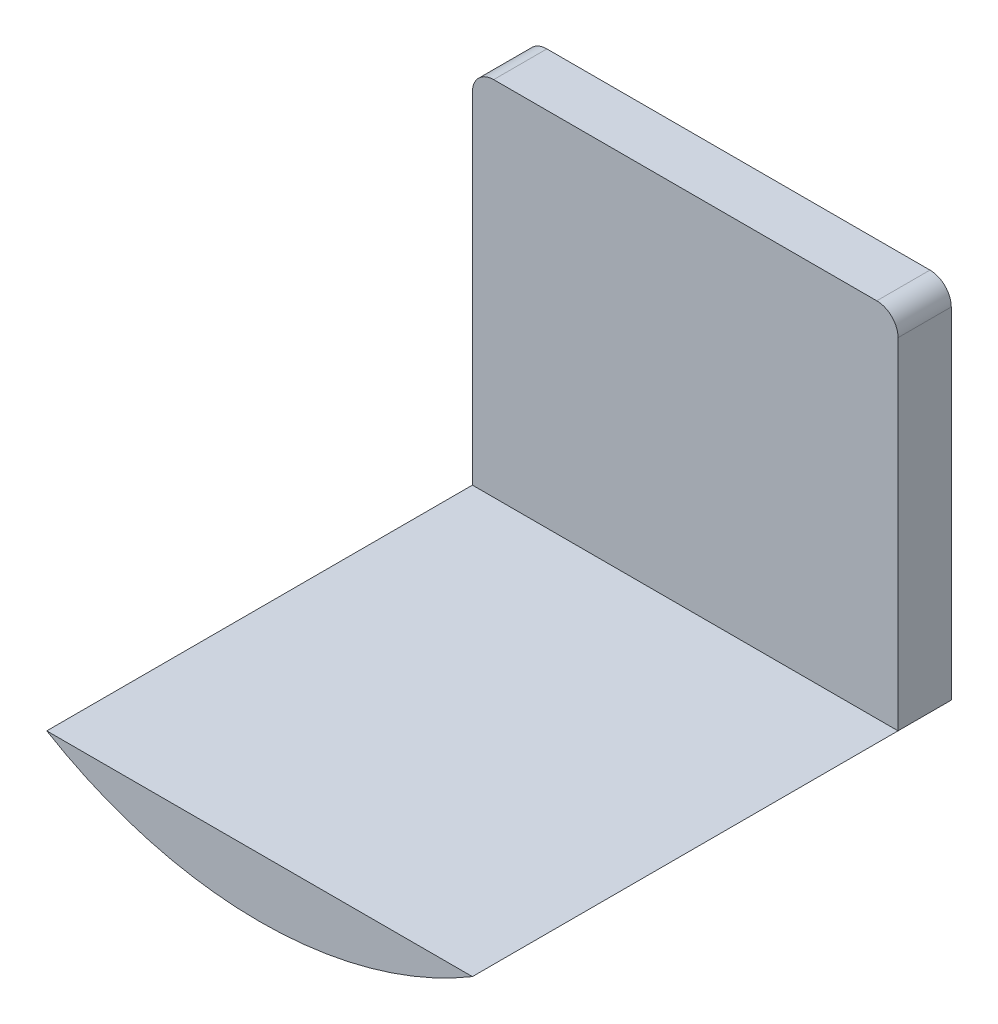
from build123d import *

# Parameters (mm, degrees)
BOSS_EXTRUDE1_DEPTH = 57.15
SKETCH2_W           = 50.8
SKETCH2_H           = 6.35
BOSS_EXTRUDE2_DEPTH = 43.18
FILLET1_R           = 2.54


with BuildPart() as part:
    # Sketch1 → Boss-Extrude1 (new body)
    with BuildSketch(Plane.XY):
        with BuildLine():
            Line((-25.4, -42.521299369), (25.4, -42.521299369))
            ThreePointArc((25.4, -42.521299369), (0, -49.53), (-25.4, -42.521299369))
        make_face()
    extrude(amount=BOSS_EXTRUDE1_DEPTH)

    # Sketch2 → Boss-Extrude2 (add)
    with BuildSketch(Plane(origin=(0, -42.521299369, 0), x_dir=(1, 0, 0), z_dir=(0, 1, 0))):
        with Locations((0, -3.175)):
            Rectangle(SKETCH2_W, SKETCH2_H)
    extrude(amount=BOSS_EXTRUDE2_DEPTH)

    # Fillet1
    fillet1_edges = [part.edges().sort_by_distance(p)[0] for p in [
        (-25.4, 0.658700631, 3.175),
        (25.4, 0.658700631, 3.175),
    ]]
    fillet(fillet1_edges, radius=FILLET1_R)


solid = part.part
